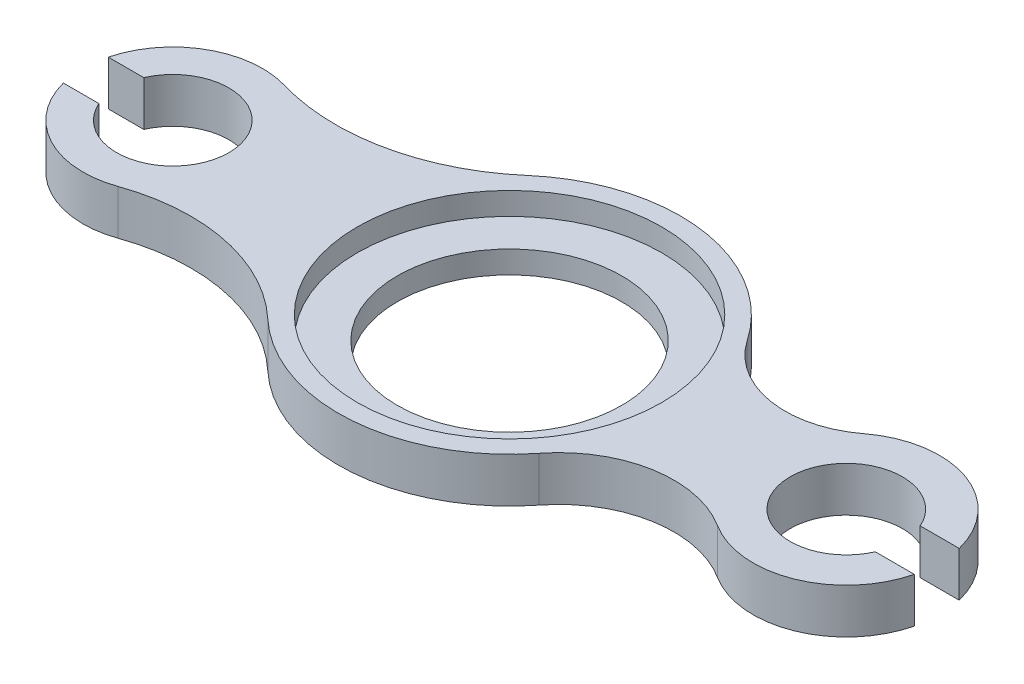
from build123d import *

# Parameters (mm, degrees)
SKETCH1_R           = 67.8
BOSS_EXTRUDE1_DEPTH = 20
SKETCH1_3_R         = 67.8
SKETCH1_3_R_2       = 50
BOSS_EXTRUDE2_DEPTH = 10


with BuildPart() as part:
    # Sketch1 → Boss-Extrude1 (new body)
    with BuildSketch(Plane(origin=(0, 0, 0), x_dir=(1, 0, 0), z_dir=(0, 1, 0))):
        with BuildLine():
            ThreePointArc((-68.95457192, 38.398915813), (-99.933181208, 34.770010311), (-118.888121928, 10))
            Line((-118.888121928, 10), (-103.07116694, 10))
            ThreePointArc((-103.07116694, 10), (-55.158288466, 0), (-103.07116694, -10))
            Line((-103.07116694, -10), (-118.888121928, -10))
            ThreePointArc((-118.888121928, -10), (-98.946037038, -35.313177478), (-66.810190141, -37.707138198))
            ThreePointArc((-66.810190141, -37.707138198), (-22.089611981, -34.732295435), (17.640354454, -55.476199781))
            ThreePointArc((17.640354454, -55.476199781), (75.663213782, -75.951962021), (129.887825017, -46.872749853))
            ThreePointArc((129.887825017, -46.872749853), (161.497288251, -27.924259237), (197.646050954, -35.098547889))
            ThreePointArc((197.646050954, -35.098547889), (235.316798867, -38.536697893), (260.147485469, -10))
            Line((260.147485469, -10), (242.754590009, -10))
            ThreePointArc((242.754590009, -10), (194.841711534, 0), (242.754590009, 10))
            Line((242.754590009, 10), (260.147485469, 10))
            ThreePointArc((260.147485469, 10), (233.604843606, 39.180755583), (194.644031062, 33.009579084))
            ThreePointArc((194.644031062, 33.009579084), (161.546937037, 24.693656308), (132.733534149, 42.979170204))
            ThreePointArc((132.733534149, 42.979170204), (79.728157262, 75.530448258), (20.130518149, 57.718174568))
            ThreePointArc((20.130518149, 57.718174568), (-21.958648504, 36.745511037), (-68.95457192, 38.398915813))
        make_face()
        with Locations((69.841711534, 0)):
            Circle(SKETCH1_R, mode=Mode.SUBTRACT)
    extrude(amount=BOSS_EXTRUDE1_DEPTH)

    # Sketch1<3> → Boss-Extrude2 (add)
    with BuildSketch(Plane(origin=(0, 0, 0), x_dir=(1, 0, 0), z_dir=(0, 1, 0))):
        with Locations((69.841711534, 0)):
            Circle(SKETCH1_3_R)
        with Locations((69.841711534, 0)):
            Circle(SKETCH1_3_R_2, mode=Mode.SUBTRACT)
    extrude(amount=BOSS_EXTRUDE2_DEPTH)


solid = part.part
